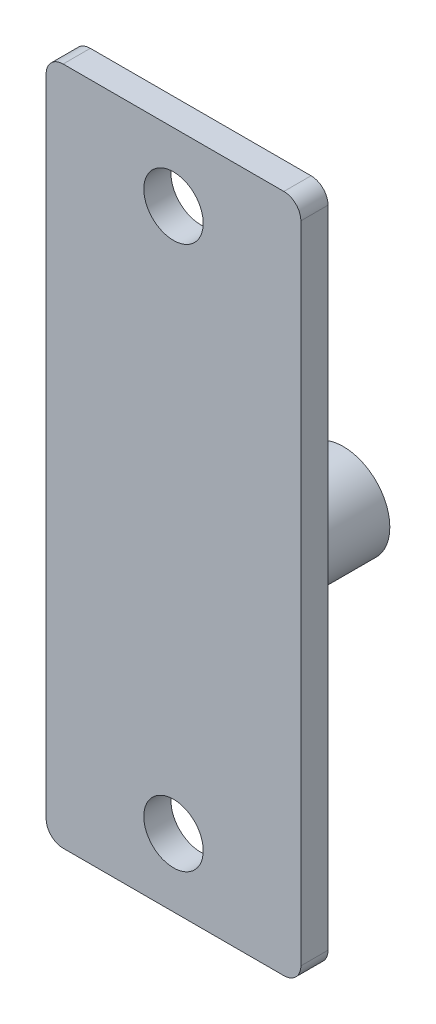
from build123d import *

# Parameters (mm, degrees)
SKETCH1_W           = 15
SKETCH1_H           = 40
SKETCH1_R           = 1.75
BOSS_EXTRUDE1_DEPTH = 1.6
FILLET1_R           = 1
SKETCH2_R           = 2.740690201
BOSS_EXTRUDE2_DEPTH = 10


with BuildPart() as part:
    # Sketch1 → Boss-Extrude1 (new body)
    with BuildSketch(Plane.XY):
        with Locations((7.5, 20)):
            Rectangle(SKETCH1_W, SKETCH1_H)
        with Locations((7.5, 4)):
            Circle(SKETCH1_R, mode=Mode.SUBTRACT)
        with Locations(Location((7.5, 36, 0), (0, 0, 180))):
            Circle(SKETCH1_R, mode=Mode.SUBTRACT)
    extrude(amount=BOSS_EXTRUDE1_DEPTH)

    # Fillet1
    fillet1_edges = [part.edges().sort_by_distance(p)[0] for p in [
        (0, 40, 0.8),
        (15, 40, 0.8),
        (15, 0, 0.8),
        (0, 0, 0.8),
    ]]
    fillet(fillet1_edges, radius=FILLET1_R)

    # Sketch2 → Boss-Extrude2 (add)
    with BuildSketch(Plane.XY.offset(1.6)):
        with Locations((7.5, 16)):
            Circle(SKETCH2_R)
    extrude(amount=-BOSS_EXTRUDE2_DEPTH)


solid = part.part
